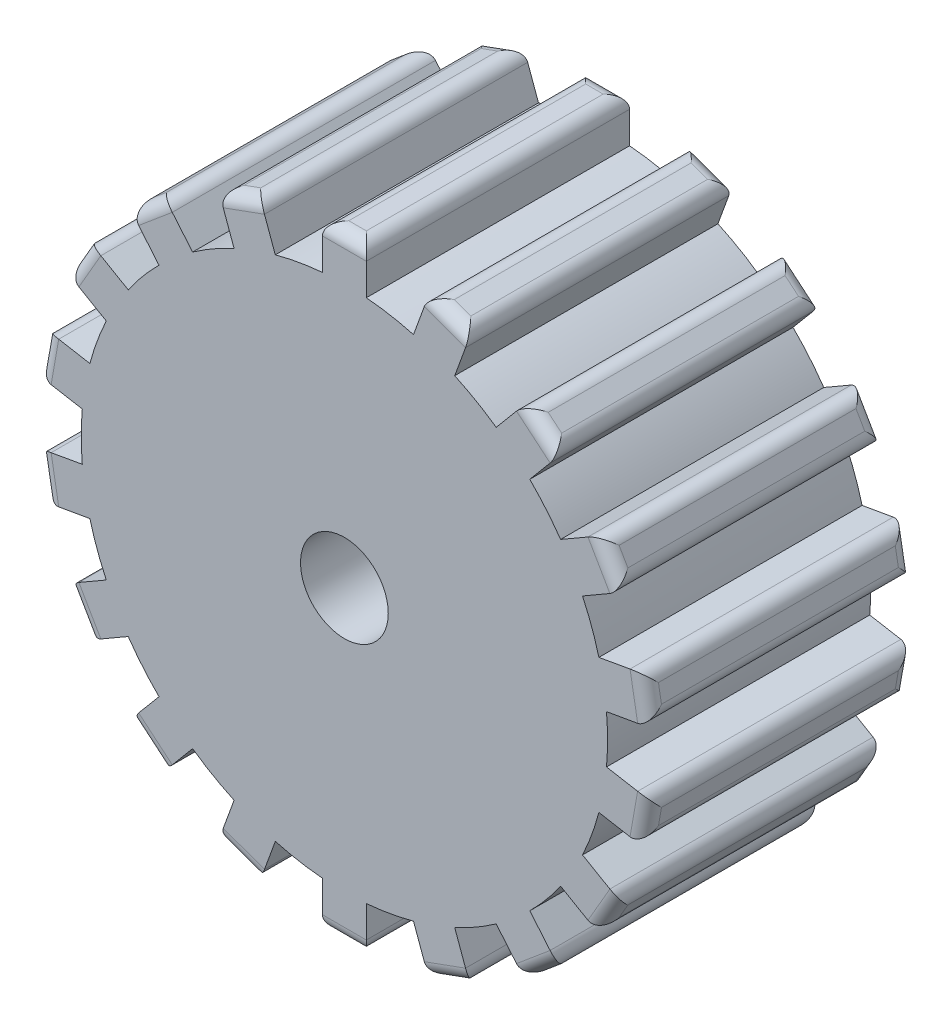
from build123d import *

# Parameters (mm, degrees)
SKETCH2_R                = 60
BOSS_EXTRUDE1_DEPTH      = 60
SKETCH3_W                = 10
SKETCH3_H                = 10.47851478
BOSS_EXTRUDE2_DEPTH      = 60
FILLET2_R                = 3
CIRPATTERN1_COUNT        = 18
FILLET2_OF_CIRPATTERN1_R = 3
SKETCH4_R                = 10
CUT_EXTRUDE1_DEPTH       = 60


with BuildPart() as part:
    # Sketch2 → Boss-Extrude1 (new body)
    with BuildSketch(Plane.XY):
        Circle(SKETCH2_R)
    extrude(amount=BOSS_EXTRUDE1_DEPTH)

    # Sketch3 → Boss-Extrude2 (add)
    with BuildSketch(Plane.XY.offset(60)):
        with Locations((0, 64.76074261)):
            Rectangle(SKETCH3_W, SKETCH3_H)
    boss_extrude2 = extrude(amount=-BOSS_EXTRUDE2_DEPTH)

    # Fillet2
    fillet2_edges = [part.edges().sort_by_distance(p)[0] for p in [
        (5, 70, 30),
        (0, 70, 0),
        (-5, 70, 30),
        (0, 70, 60),
    ]]
    fillet(fillet2_edges, radius=FILLET2_R)

    # CirPattern1: Boss-Extrude2 ×18 about axis
    cirpattern1_axis = Axis((0, 0, 0), (0, 0, 1))
    for i in range(1, CIRPATTERN1_COUNT):
        add(boss_extrude2.rotate(cirpattern1_axis, i * 360 / CIRPATTERN1_COUNT))

    # Fillet2 of CirPattern1
    fillet2_of_cirpattern1_edges = [part.edges().sort_by_distance(p)[0] for p in [
        (-19.242946929, 67.488584172, 30),
        (-23.941410033, 65.778483455, 0),
        (-28.639873137, 64.068382738, 30),
        (-23.941410033, 65.778483455, 60),
        (-41.164910462, 56.837049067, 30),
        (-44.995132678, 53.623111018, 0),
        (-48.825354894, 50.40917297, 30),
        (-44.995132678, 53.623111018, 60),
        (-58.121778265, 39.330127019, 30),
        (-60.621778265, 35, 0),
        (-63.121778265, 30.669872981, 30),
        (-60.621778265, 35, 60),
        (-68.068301823, 17.079411202, 30),
        (-68.936542711, 12.155372437, 0),
        (-69.804783599, 7.231333672, 30),
        (-68.936542711, 12.155372437, 60),
        (-69.804783599, -7.231333672, 30),
        (-68.936542711, -12.155372437, 0),
        (-68.068301823, -17.079411202, 30),
        (-68.936542711, -12.155372437, 60),
        (-63.121778265, -30.669872981, 30),
        (-60.621778265, -35, 0),
        (-58.121778265, -39.330127019, 30),
        (-60.621778265, -35, 60),
        (-48.825354894, -50.40917297, 30),
        (-44.995132678, -53.623111018, 0),
        (-41.164910462, -56.837049067, 30),
        (-44.995132678, -53.623111018, 60),
        (-28.639873137, -64.068382738, 30),
        (-23.941410033, -65.778483455, 0),
        (-19.242946929, -67.488584172, 30),
        (-23.941410033, -65.778483455, 60),
        (-5, -70, 30),
        (0, -70, 0),
        (5, -70, 30),
        (0, -70, 60),
        (19.242946929, -67.488584172, 30),
        (23.941410033, -65.778483455, 0),
        (28.639873137, -64.068382738, 30),
        (23.941410033, -65.778483455, 60),
        (41.164910462, -56.837049067, 30),
        (44.995132678, -53.623111018, 0),
        (48.825354894, -50.40917297, 30),
        (44.995132678, -53.623111018, 60),
        (58.121778265, -39.330127019, 30),
        (60.621778265, -35, 0),
        (63.121778265, -30.669872981, 30),
        (60.621778265, -35, 60),
        (68.068301823, -17.079411202, 30),
        (68.936542711, -12.155372437, 0),
        (69.804783599, -7.231333672, 30),
        (68.936542711, -12.155372437, 60),
        (69.804783599, 7.231333672, 30),
        (68.936542711, 12.155372437, 0),
        (68.068301823, 17.079411202, 30),
        (68.936542711, 12.155372437, 60),
        (63.121778265, 30.669872981, 30),
        (60.621778265, 35, 0),
        (58.121778265, 39.330127019, 30),
        (60.621778265, 35, 60),
        (48.825354894, 50.40917297, 30),
        (44.995132678, 53.623111018, 0),
        (41.164910462, 56.837049067, 30),
        (44.995132678, 53.623111018, 60),
        (28.639873137, 64.068382738, 30),
        (23.941410033, 65.778483455, 0),
        (19.242946929, 67.488584172, 30),
        (23.941410033, 65.778483455, 60),
    ]]
    fillet(fillet2_of_cirpattern1_edges, radius=FILLET2_OF_CIRPATTERN1_R)

    # Sketch4 → Cut-Extrude1 (cut)
    with BuildSketch(Plane.XY.offset(60)):
        Circle(SKETCH4_R)
    extrude(amount=-CUT_EXTRUDE1_DEPTH, mode=Mode.SUBTRACT)


solid = part.part
